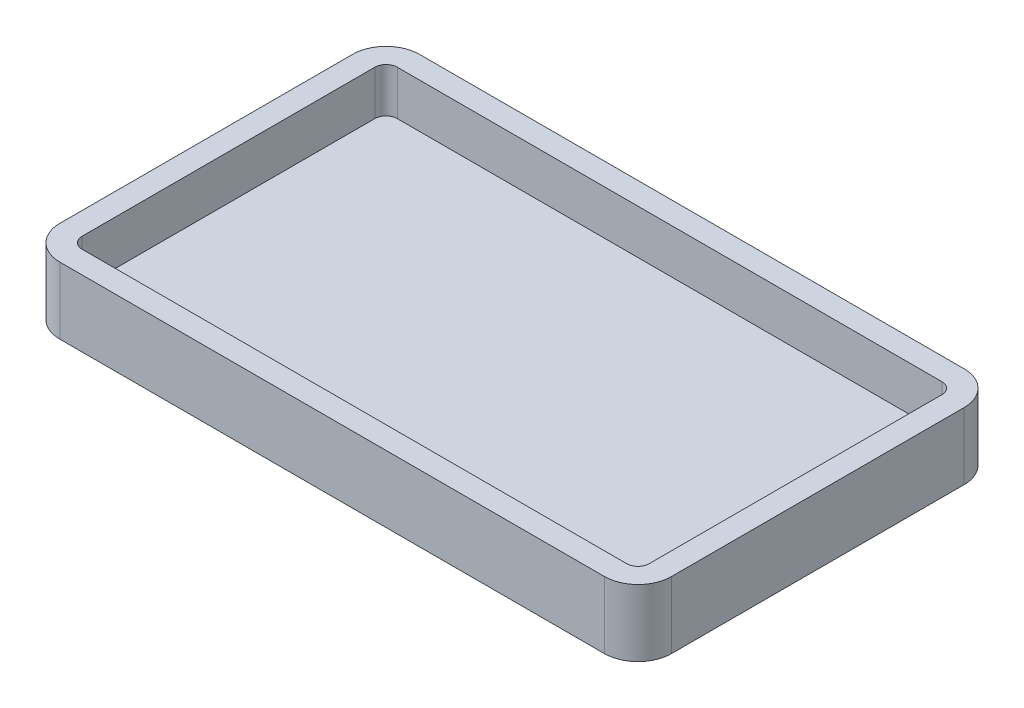
from build123d import *

# Parameters (mm, degrees)
EXTRUDE1_DEPTH = 9.525
EXTRUDE2_DEPTH = 6.35


with BuildPart() as part:
    # Sketch1 → Extrude1 (new body)
    with BuildSketch(Plane(origin=(0, 0, 0), x_dir=(1, 0, 0), z_dir=(0, 1, 0))):
        with BuildLine():
            Line((4.7752, 0), (82.475669818, 0))
            ThreePointArc((82.475669818, 0), (85.852246119, 1.398623698), (87.250869818, 4.7752))
            Line((87.250869818, 4.7752), (87.250869818, 46.540933005))
            ThreePointArc((87.250869818, 46.540933005), (85.852246119, 49.917509306), (82.475669818, 51.316133005))
            Line((82.475669818, 51.316133005), (4.7752, 51.316133005))
            ThreePointArc((4.7752, 51.316133005), (1.398623698, 49.917509306), (0, 46.540933005))
            Line((0, 46.540933005), (0, 4.7752))
            ThreePointArc((0, 4.7752), (1.398623698, 1.398623698), (4.7752, 0))
        make_face()
    extrude(amount=-EXTRUDE1_DEPTH)

    # Sketch2 → Extrude2 (cut)
    with BuildSketch(Plane(origin=(0, 0, 0), x_dir=(1, 0, 0), z_dir=(0, 1, 0))):
        with BuildLine():
            Line((3.175, 46.540933005), (3.175, 4.7752))
            ThreePointArc((3.175, 4.7752), (3.643687729, 3.643687729), (4.7752, 3.175))
            Line((4.7752, 3.175), (82.475669818, 3.175))
            ThreePointArc((82.475669818, 3.175), (83.607182089, 3.643687729), (84.075869818, 4.7752))
            Line((84.075869818, 4.7752), (84.075869818, 46.540933005))
            ThreePointArc((84.075869818, 46.540933005), (83.607182089, 47.672445276), (82.475669818, 48.141133005))
            Line((82.475669818, 48.141133005), (4.7752, 48.141133005))
            ThreePointArc((4.7752, 48.141133005), (3.643687729, 47.672445276), (3.175, 46.540933005))
        make_face()
    extrude(amount=-EXTRUDE2_DEPTH, mode=Mode.SUBTRACT)


solid = part.part
